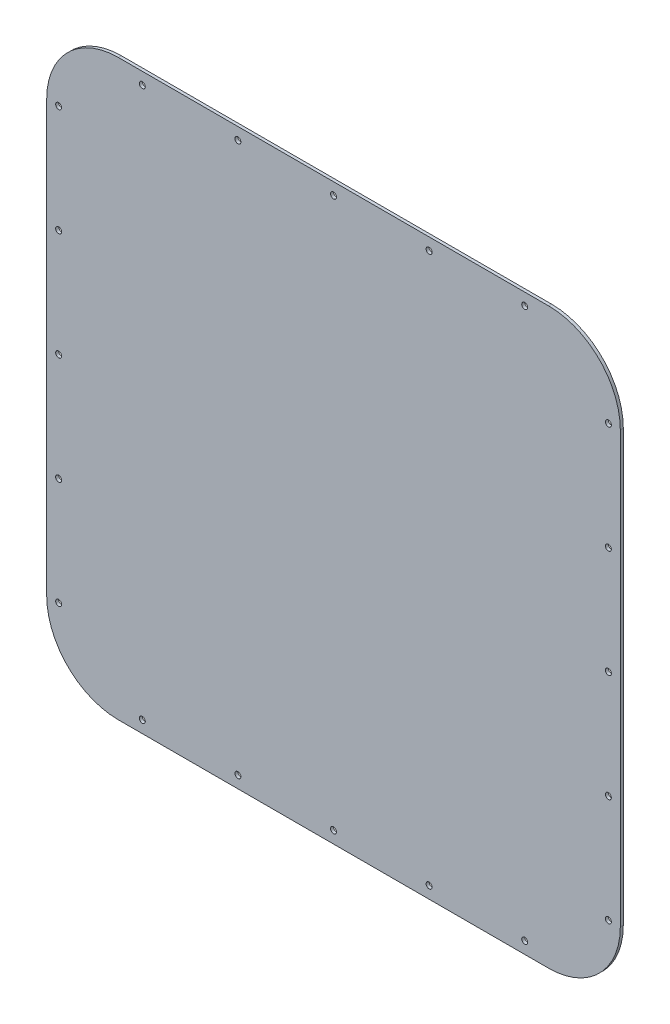
from build123d import *

# Parameters (mm, degrees)
MODEL_R             = 3.175
BOSS_EXTRUDE1_DEPTH = 3.175


with BuildPart() as part:
    # Model → Boss-Extrude1 (new body)
    with BuildSketch(Plane.XY):
        with BuildLine():
            Line((-152.4, -939.8), (-609.6, -939.8))
            ThreePointArc((-609.6, -939.8), (-663.481536726, -962.118463274), (-685.8, -1016))
            Line((-685.8, -1016), (-685.8, -1473.2))
            ThreePointArc((-685.8, -1473.2), (-663.481536726, -1527.081536726), (-609.6, -1549.4))
            Line((-609.6, -1549.4), (-152.4, -1549.4))
            ThreePointArc((-152.4, -1549.4), (-98.518463274, -1527.081536726), (-76.2, -1473.2))
            Line((-76.2, -1473.2), (-76.2, -1016))
            ThreePointArc((-76.2, -1016), (-98.518463274, -962.118463274), (-152.4, -939.8))
        make_face()
        with Locations((-381, -952.5)):
            Circle(MODEL_R, mode=Mode.SUBTRACT)
        with Locations((-88.9, -1473.432930672)):
            Circle(MODEL_R, mode=Mode.SUBTRACT)
        with Locations((-88.9, -1359.132930672)):
            Circle(MODEL_R, mode=Mode.SUBTRACT)
        with Locations((-88.9, -1244.832930672)):
            Circle(MODEL_R, mode=Mode.SUBTRACT)
        with Locations((-88.9, -1130.532930672)):
            Circle(MODEL_R, mode=Mode.SUBTRACT)
        with Locations((-482.6, -1536.7)):
            Circle(MODEL_R, mode=Mode.SUBTRACT)
        with Locations((-584.2, -1536.7)):
            Circle(MODEL_R, mode=Mode.SUBTRACT)
        with Locations((-673.1, -1244.832930672)):
            Circle(MODEL_R, mode=Mode.SUBTRACT)
        with Locations((-279.4, -952.5)):
            Circle(MODEL_R, mode=Mode.SUBTRACT)
        with Locations((-482.6, -952.5)):
            Circle(MODEL_R, mode=Mode.SUBTRACT)
        with Locations((-584.2, -952.5)):
            Circle(MODEL_R, mode=Mode.SUBTRACT)
        with Locations((-177.8, -952.5)):
            Circle(MODEL_R, mode=Mode.SUBTRACT)
        with Locations((-88.9, -1016.232930672)):
            Circle(MODEL_R, mode=Mode.SUBTRACT)
        with Locations((-673.1, -1016.232930672)):
            Circle(MODEL_R, mode=Mode.SUBTRACT)
        with Locations((-673.1, -1130.532930672)):
            Circle(MODEL_R, mode=Mode.SUBTRACT)
        with Locations((-673.1, -1473.432930672)):
            Circle(MODEL_R, mode=Mode.SUBTRACT)
        with Locations((-381, -1536.7)):
            Circle(MODEL_R, mode=Mode.SUBTRACT)
        with Locations((-279.4, -1536.7)):
            Circle(MODEL_R, mode=Mode.SUBTRACT)
        with Locations((-177.8, -1536.7)):
            Circle(MODEL_R, mode=Mode.SUBTRACT)
        with Locations((-673.1, -1359.132930672)):
            Circle(MODEL_R, mode=Mode.SUBTRACT)
    extrude(amount=BOSS_EXTRUDE1_DEPTH)


solid = part.part
